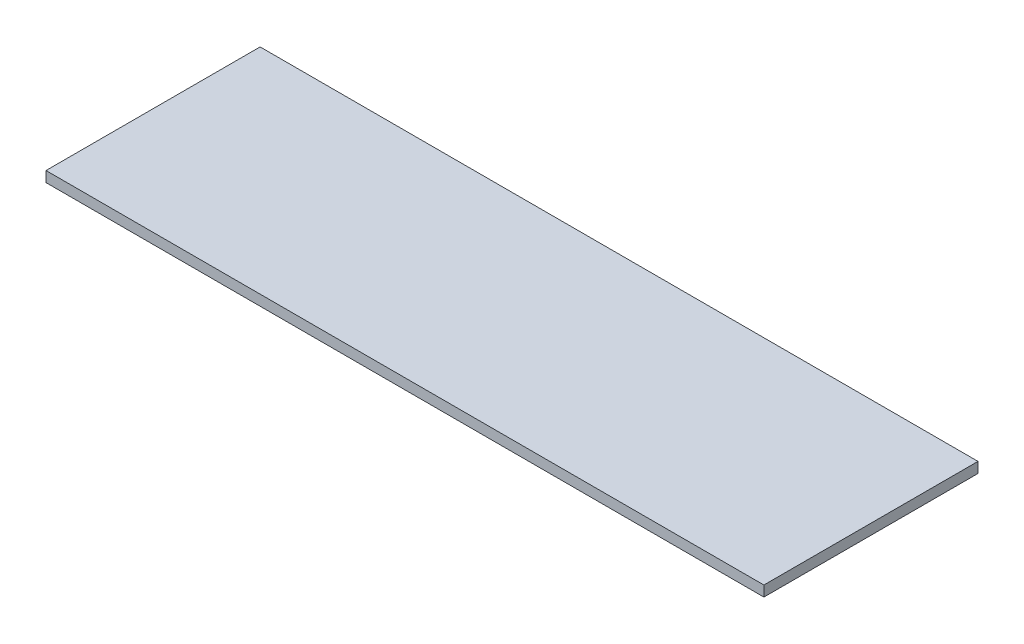
from build123d import *

# Parameters (mm, degrees)
SKETCH1_W           = 342
SKETCH1_H           = 102
BOSS_EXTRUDE1_DEPTH = 5


with BuildPart() as part:
    # Sketch1 → Boss-Extrude1 (new body)
    with BuildSketch(Plane(origin=(0, 0, 0), x_dir=(1, 0, 0), z_dir=(0, 1, 0))):
        Rectangle(SKETCH1_W, SKETCH1_H)
    extrude(amount=BOSS_EXTRUDE1_DEPTH)


solid = part.part
